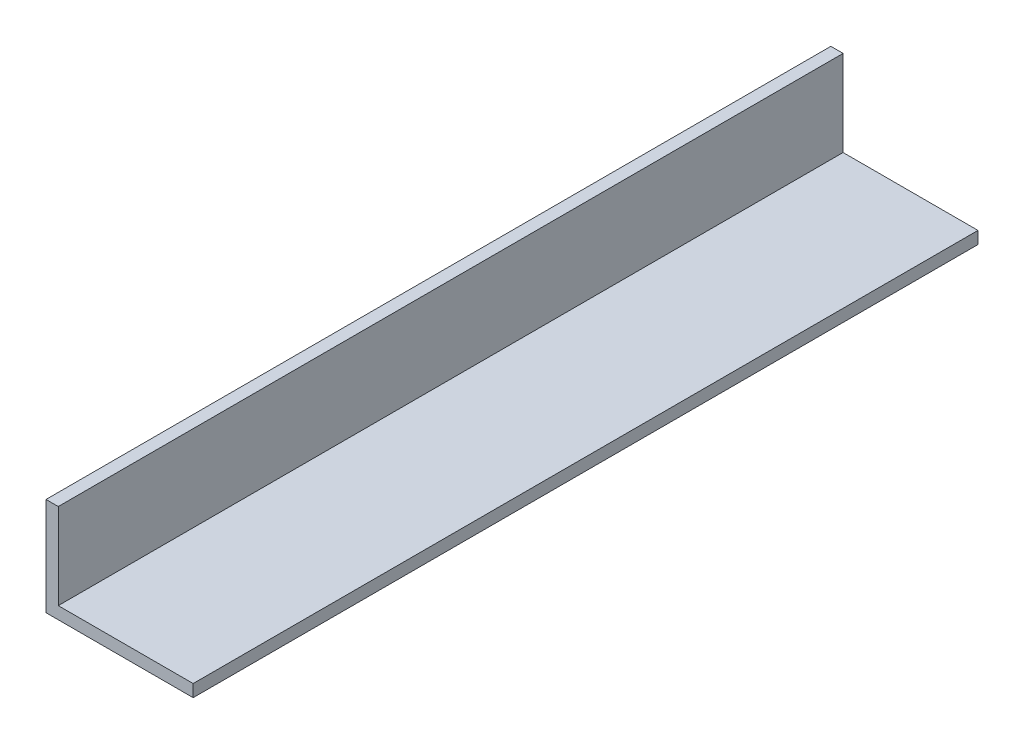
from build123d import *

# Parameters (mm, degrees)
BOSS_EXTRUDE1_DEPTH = 101.6


with BuildPart() as part:
    # Sketch3 → Boss-Extrude1 (new body)
    with BuildSketch(Plane.XY):
        Polygon((0, 0), (19.05, 0), (19.05, 1.5875), (1.5875, 1.5875), (1.5875, 12.7), (0, 12.7), align=None)
    extrude(amount=BOSS_EXTRUDE1_DEPTH)


solid = part.part
